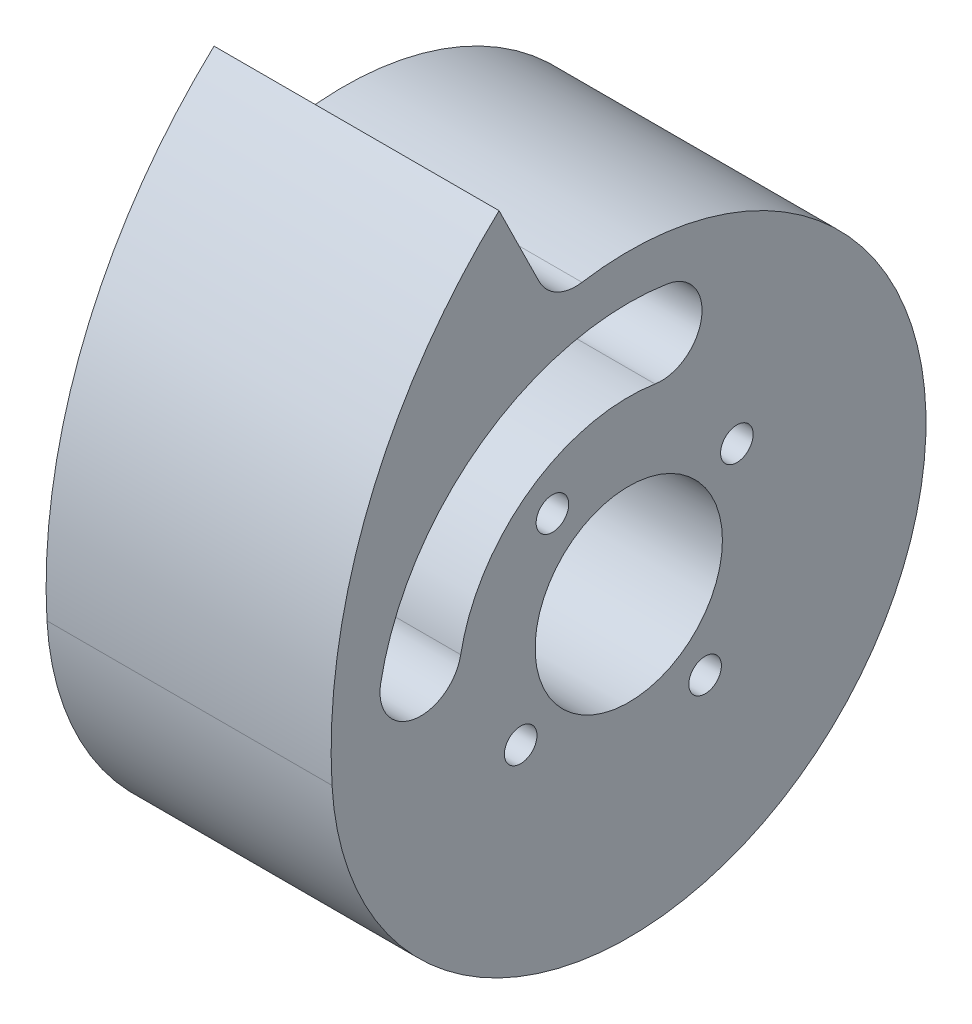
from build123d import *

# Parameters (mm, degrees)
ESBO_O1_R                = 11.5
RESSALTO_EXTRUS_O1_DEPTH = 17.5
FILLET1_R                = 5
ESBO_O2_R                = 2
CORTE_EXTRUS_O1_DEPTH    = 10


with BuildPart() as part:
    # Esboço1 → Ressalto-extrusão1 (new, symmetric)
    with BuildSketch(Plane(origin=(0, 0, 0), x_dir=(0, 0, -1), z_dir=(1, 0, 0))):
        with BuildLine():
            Line((-9.301463672, 35.294939773), (-15.923932545, 48.753873832))
            ThreePointArc((-15.923932545, 48.753873832), (-31.882117783, 25.625328571), (-36.439403175, -2.102354921))
            ThreePointArc((-36.439403175, -2.102354921), (29.541430866, -21.43720743), (-9.301463672, 35.294939773))
        make_face()
        Circle(ESBO_O1_R, mode=Mode.SUBTRACT)
        with BuildLine():
            ThreePointArc((-30.461709826, 5.751889646), (-17.884176458, 25.321063019), (4.764081686, 30.631740494))
            ThreePointArc((4.764081686, 30.631740494), (8.936284719, 24.922736917), (3.227281142, 20.750533883))
            ThreePointArc((3.227281142, 20.750533883), (-12.115087278, 17.152978174), (-20.635351817, 3.896441373))
            ThreePointArc((-20.635351817, 3.896441373), (-26.476254958, -0.089013495), (-30.461709826, 5.751889646))
        make_face(mode=Mode.SUBTRACT)
    extrude(amount=RESSALTO_EXTRUS_O1_DEPTH, both=True)

    # Fillet1
    fillet1_edges = [part.edges().sort_by_distance(p)[0] for p in [
        (0, 35.294939773, 9.301463672),
    ]]
    fillet(fillet1_edges, radius=FILLET1_R)

    # Esboço2 → Corte-extrusão1 (cut)
    with BuildSketch(Plane(origin=(17.5, 0, 0), x_dir=(0, 0, -1), z_dir=(1, 0, 0))):
        with Locations((-9.374769917, 13.273137873)):
            Circle(ESBO_O2_R)
        with Locations((13.273137873, 9.374769917)):
            Circle(ESBO_O2_R)
        with Locations((9.374769917, -13.273137873)):
            Circle(ESBO_O2_R)
        with Locations((-13.273137873, -9.374769917)):
            Circle(ESBO_O2_R)
    extrude(amount=-CORTE_EXTRUS_O1_DEPTH, mode=Mode.SUBTRACT)


solid = part.part
